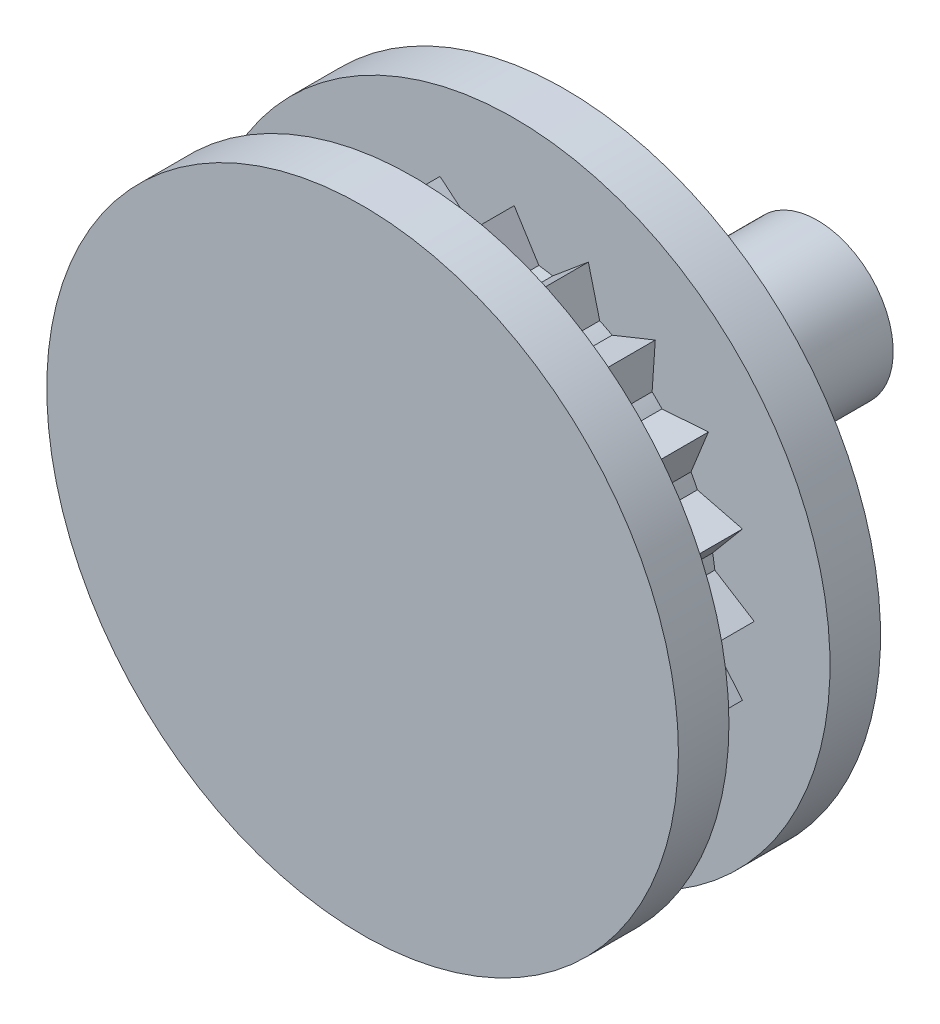
from build123d import *

# Parameters (mm, degrees)
BOSS_EXTRUDE1_DEPTH = 4
SKETCH3_R           = 12.5
BOSS_EXTRUDE2_DEPTH = 2
BOSS_EXTRUDE3_START = 2
SKETCH4_R           = 12.5
BOSS_EXTRUDE3_DEPTH = 2
SKETCH5_R           = 3
BOSS_EXTRUDE4_DEPTH = 10
SKETCH6_R           = 5
SKETCH6_R_2         = 3
BOSS_EXTRUDE5_DEPTH = 2


with BuildPart() as part:
    # Sketch2 → Boss-Extrude1 (new body)
    with BuildSketch(Plane.XY):
        with BuildLine():
            Line((0, 9.5), (-0.977834373, 7.940015109))
            ThreePointArc((-0.977834373, 7.940015109), (-1.25147572, 7.901506725), (-1.523623852, 7.853570548))
            Line((-1.523623852, 7.853570548), (-2.935661447, 9.035036905))
            Line((-2.935661447, 9.035036905), (-3.383575357, 7.24923567))
            ThreePointArc((-3.383575357, 7.24923567), (-3.631923998, 7.128052194), (-3.875939159, 6.998363783))
            Line((-3.875939159, 6.998363783), (-5.583959897, 7.685661447))
            Line((-5.583959897, 7.685661447), (-5.45810841, 5.848850535))
            ThreePointArc((-5.45810841, 5.848850535), (-5.656854249, 5.656854249), (-5.848850535, 5.45810841))
            Line((-5.848850535, 5.45810841), (-7.685661447, 5.583959897))
            Line((-7.685661447, 5.583959897), (-6.998363783, 3.875939159))
            ThreePointArc((-6.998363783, 3.875939159), (-7.128052194, 3.631923998), (-7.24923567, 3.383575357))
            Line((-7.24923567, 3.383575357), (-9.035036905, 2.935661447))
            Line((-9.035036905, 2.935661447), (-7.853570548, 1.523623852))
            ThreePointArc((-7.853570548, 1.523623852), (-7.901506725, 1.25147572), (-7.940015109, 0.977834373))
            Line((-7.940015109, 0.977834373), (-9.5, 0))
            Line((-9.5, 0), (-7.940015109, -0.977834373))
            ThreePointArc((-7.940015109, -0.977834373), (-7.901506725, -1.25147572), (-7.853570548, -1.523623852))
            Line((-7.853570548, -1.523623852), (-9.035036905, -2.935661447))
            Line((-9.035036905, -2.935661447), (-7.24923567, -3.383575357))
            ThreePointArc((-7.24923567, -3.383575357), (-7.128052194, -3.631923998), (-6.998363783, -3.875939159))
            Line((-6.998363783, -3.875939159), (-7.685661447, -5.583959897))
            Line((-7.685661447, -5.583959897), (-5.848850535, -5.45810841))
            ThreePointArc((-5.848850535, -5.45810841), (-5.656854249, -5.656854249), (-5.45810841, -5.848850535))
            Line((-5.45810841, -5.848850535), (-5.583959897, -7.685661447))
            Line((-5.583959897, -7.685661447), (-3.875939159, -6.998363783))
            ThreePointArc((-3.875939159, -6.998363783), (-3.631923998, -7.128052194), (-3.383575357, -7.24923567))
            Line((-3.383575357, -7.24923567), (-2.935661447, -9.035036905))
            Line((-2.935661447, -9.035036905), (-1.523623852, -7.853570548))
            ThreePointArc((-1.523623852, -7.853570548), (-1.25147572, -7.901506725), (-0.977834373, -7.940015109))
            Line((-0.977834373, -7.940015109), (0, -9.5))
            Line((0, -9.5), (0.977834373, -7.940015109))
            ThreePointArc((0.977834373, -7.940015109), (1.25147572, -7.901506725), (1.523623852, -7.853570548))
            Line((1.523623852, -7.853570548), (2.935661447, -9.035036905))
            Line((2.935661447, -9.035036905), (3.383575357, -7.24923567))
            ThreePointArc((3.383575357, -7.24923567), (3.631923998, -7.128052194), (3.875939159, -6.998363783))
            Line((3.875939159, -6.998363783), (5.583959897, -7.685661447))
            Line((5.583959897, -7.685661447), (5.45810841, -5.848850535))
            ThreePointArc((5.45810841, -5.848850535), (5.656854249, -5.656854249), (5.848850535, -5.45810841))
            Line((5.848850535, -5.45810841), (7.685661447, -5.583959897))
            Line((7.685661447, -5.583959897), (6.998363783, -3.875939159))
            ThreePointArc((6.998363783, -3.875939159), (7.128052194, -3.631923998), (7.24923567, -3.383575357))
            Line((7.24923567, -3.383575357), (9.035036905, -2.935661447))
            Line((9.035036905, -2.935661447), (7.853570548, -1.523623852))
            ThreePointArc((7.853570548, -1.523623852), (7.901506725, -1.25147572), (7.940015109, -0.977834373))
            Line((7.940015109, -0.977834373), (9.5, 0))
            Line((9.5, 0), (7.940015109, 0.977834373))
            ThreePointArc((7.940015109, 0.977834373), (7.901506725, 1.25147572), (7.853570548, 1.523623852))
            Line((7.853570548, 1.523623852), (9.035036905, 2.935661447))
            Line((9.035036905, 2.935661447), (7.24923567, 3.383575357))
            ThreePointArc((7.24923567, 3.383575357), (7.128052194, 3.631923998), (6.998363783, 3.875939159))
            Line((6.998363783, 3.875939159), (7.685661447, 5.583959897))
            Line((7.685661447, 5.583959897), (5.848850535, 5.45810841))
            ThreePointArc((5.848850535, 5.45810841), (5.656854249, 5.656854249), (5.45810841, 5.848850535))
            Line((5.45810841, 5.848850535), (5.583959897, 7.685661447))
            Line((5.583959897, 7.685661447), (3.875939159, 6.998363783))
            ThreePointArc((3.875939159, 6.998363783), (3.631923998, 7.128052194), (3.383575357, 7.24923567))
            Line((3.383575357, 7.24923567), (2.935661447, 9.035036905))
            Line((2.935661447, 9.035036905), (1.523623852, 7.853570548))
            ThreePointArc((1.523623852, 7.853570548), (1.25147572, 7.901506725), (0.977834373, 7.940015109))
            Line((0.977834373, 7.940015109), (0, 9.5))
        make_face()
    extrude(amount=BOSS_EXTRUDE1_DEPTH)

    # Sketch3 → Boss-Extrude2 (add)
    with BuildSketch(Plane.XY.offset(4)):
        Circle(SKETCH3_R)
    extrude(amount=BOSS_EXTRUDE2_DEPTH)

    # Sketch4 → Boss-Extrude3 (add)
    with BuildSketch(Plane(origin=(0, 0, 0), x_dir=(-1, 0, 0), z_dir=(0, 0, -1)).offset(BOSS_EXTRUDE3_START)):
        with Locations(Location((0, 0, 0), (0, 0, 180))):
            Circle(SKETCH4_R)
    extrude(amount=-BOSS_EXTRUDE3_DEPTH)

    # Sketch5 → Boss-Extrude4 (add)
    with BuildSketch(Plane(origin=(0, 0, -2), x_dir=(-1, 0, 0), z_dir=(0, 0, -1))):
        Circle(SKETCH5_R)
    extrude(amount=BOSS_EXTRUDE4_DEPTH)

    # Sketch6 → Boss-Extrude5 (add)
    with BuildSketch(Plane(origin=(0, 0, -2), x_dir=(-1, 0, 0), z_dir=(0, 0, -1))):
        Circle(SKETCH6_R)
        Circle(SKETCH6_R_2, mode=Mode.SUBTRACT)
    extrude(amount=BOSS_EXTRUDE5_DEPTH)


solid = part.part
